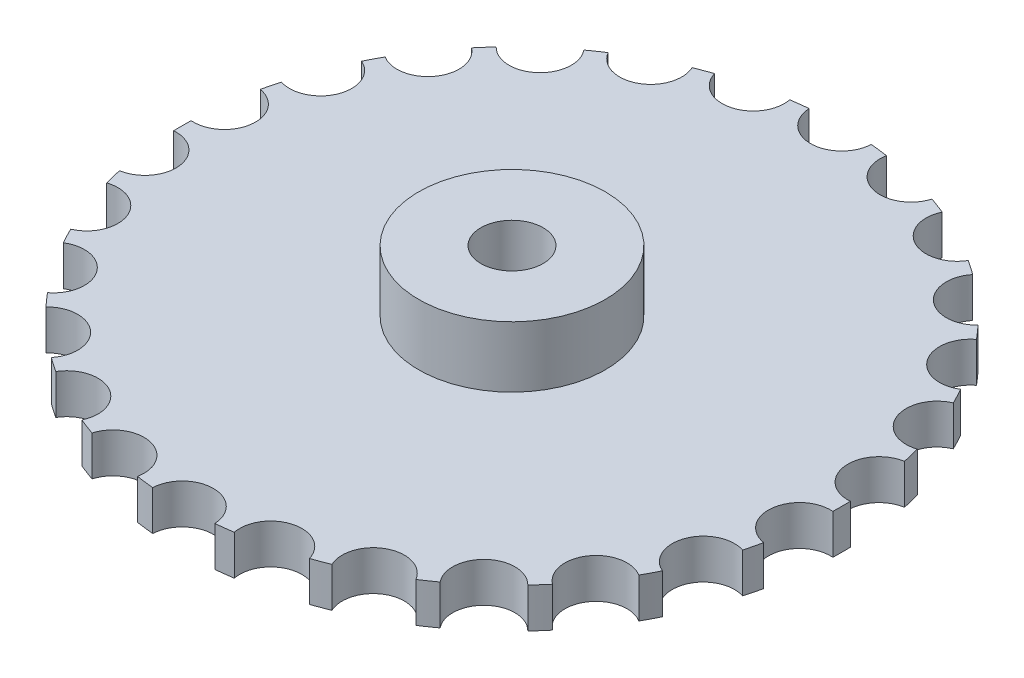
from build123d import *

# Parameters (mm, degrees)
SKETCH2_R               = 26.5
BOSS_EXTRUDE1_DEPTH     = 1.6
CUT_EXTRUDE2_DEPTH      = 38.510798445
CUT_EXTRUDE2_DEPTH_BACK = 38.510798445
SKETCH1_R               = 2.5
SKETCH3_R               = 7.5
BOSS_EXTRUDE2_DEPTH     = 6.5
F_5_0MM_DOWEL_HOLE2_D   = 5


with BuildPart() as part:
    # Sketch2 → Boss-Extrude1 (new, symmetric)
    with BuildSketch(Plane(origin=(0, 0, 0), x_dir=(1, 0, 0), z_dir=(0, 1, 0))):
        with Locations(Location((0, 0, 0), (0, 0, 90))):
            Circle(SKETCH2_R)
    extrude(amount=BOSS_EXTRUDE1_DEPTH, both=True)

    # Sketch1 → Cut-Extrude2 (cut, two sides: drawn at the far end of the back side and taken through both)
    with BuildSketch(Plane(origin=(0, 0, 0), x_dir=(1, 0, 0), z_dir=(0, 1, 0)).offset(-CUT_EXTRUDE2_DEPTH_BACK)):
        with Locations((0, 26.5)):
            Circle(SKETCH1_R)
        with Locations((6.341865104, 25.729958162)):
            Circle(SKETCH1_R)
        with Locations((12.315164059, 23.46458468)):
            Circle(SKETCH1_R)
        with Locations((17.572750443, 19.835534827)):
            Circle(SKETCH1_R)
        with Locations((21.809072446, 15.053715788)):
            Circle(SKETCH1_R)
        with Locations((24.777930431, 9.397029507)):
            Circle(SKETCH1_R)
        with Locations((26.306785164, 3.194222027)):
            Circle(SKETCH1_R)
        with Locations((26.306785164, -3.194222027)):
            Circle(SKETCH1_R)
        with Locations((24.777930431, -9.397029507)):
            Circle(SKETCH1_R)
        with Locations((21.809072446, -15.053715788)):
            Circle(SKETCH1_R)
        with Locations((17.572750443, -19.835534827)):
            Circle(SKETCH1_R)
        with Locations((12.315164059, -23.46458468)):
            Circle(SKETCH1_R)
        with Locations((6.341865104, -25.729958162)):
            Circle(SKETCH1_R)
        with Locations((0, -26.5)):
            Circle(SKETCH1_R)
        with Locations((-6.341865104, -25.729958162)):
            Circle(SKETCH1_R)
        with Locations((-12.315164059, -23.46458468)):
            Circle(SKETCH1_R)
        with Locations((-17.572750443, -19.835534827)):
            Circle(SKETCH1_R)
        with Locations((-21.809072446, -15.053715788)):
            Circle(SKETCH1_R)
        with Locations((-24.777930431, -9.397029507)):
            Circle(SKETCH1_R)
        with Locations((-26.306785164, -3.194222027)):
            Circle(SKETCH1_R)
        with Locations((-26.306785164, 3.194222027)):
            Circle(SKETCH1_R)
        with Locations((-24.777930431, 9.397029507)):
            Circle(SKETCH1_R)
        with Locations((-21.809072446, 15.053715788)):
            Circle(SKETCH1_R)
        with Locations((-17.572750443, 19.835534827)):
            Circle(SKETCH1_R)
        with Locations((-12.315164059, 23.46458468)):
            Circle(SKETCH1_R)
        with Locations((-6.341865104, 25.729958162)):
            Circle(SKETCH1_R)
    extrude(amount=CUT_EXTRUDE2_DEPTH + CUT_EXTRUDE2_DEPTH_BACK, mode=Mode.SUBTRACT)

    # Sketch3 → Boss-Extrude2 (add, symmetric)
    with BuildSketch(Plane(origin=(0, 0, 0), x_dir=(1, 0, 0), z_dir=(0, 1, 0))):
        with Locations(Location((0, 0, 0), (0, 0, 90))):
            Circle(SKETCH3_R)
    extrude(amount=BOSS_EXTRUDE2_DEPTH, both=True)

    # Ø5.0mm Dowel Hole2 (through all)
    with Locations(Plane(origin=(0, 6.5, 0), x_dir=(1, 0, 0), z_dir=(0, 1, 0))):
        with Locations((0, 0)):
            Hole(F_5_0MM_DOWEL_HOLE2_D / 2)


solid = part.part
